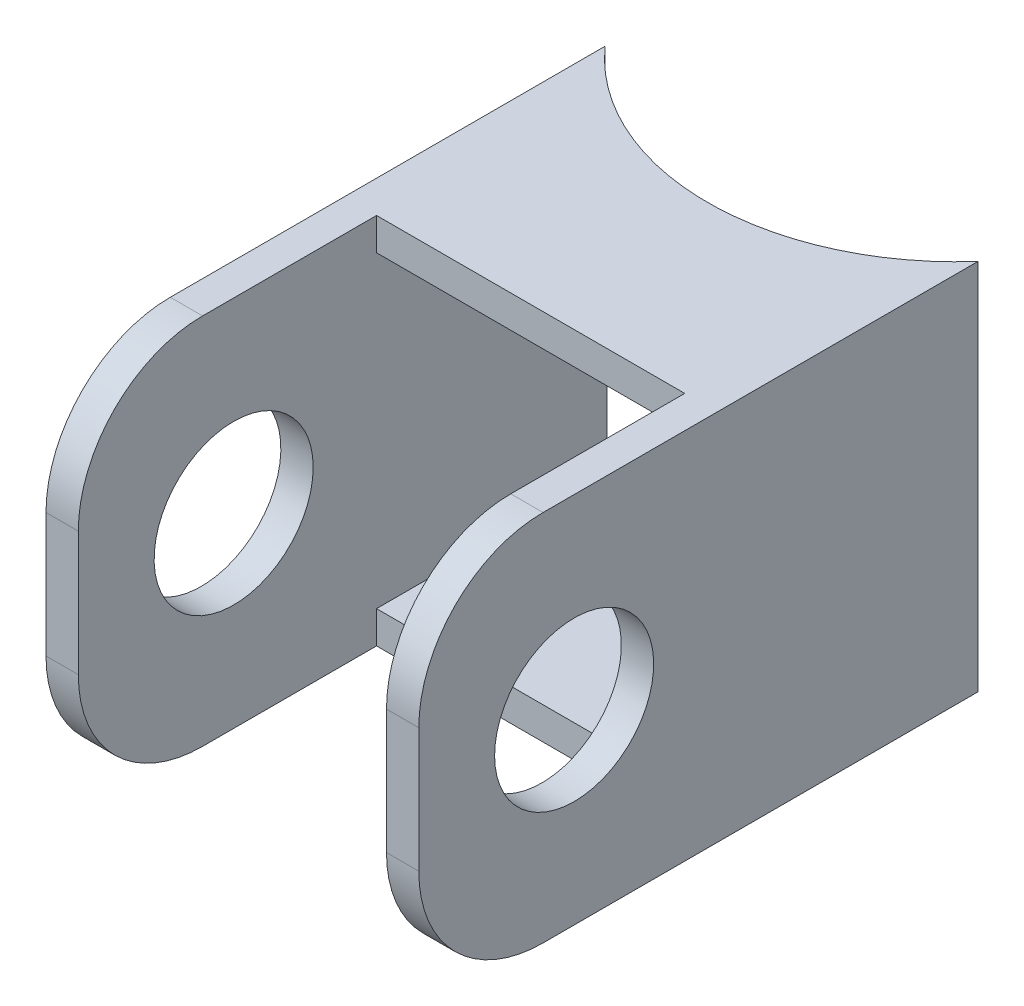
from build123d import *

# Parameters (mm, degrees)
SKETCH1_W               = 19.05
SKETCH1_H               = 19.05
SKETCH1_W_2             = 15.748
SKETCH1_H_2             = 15.748
BOSS_EXTRUDE1_DEPTH     = 28.575
CUT_EXTRUDE5_DEPTH      = 36.639286609
CUT_EXTRUDE5_DEPTH_BACK = 36.639286609
SKETCH5_R               = 12.7
CUT_EXTRUDE2_DEPTH      = 36.639286609
CUT_EXTRUDE2_DEPTH_BACK = 36.639286609
SKETCH3_R               = 4.064
CUT_EXTRUDE4_DEPTH      = 36.639286609
CUT_EXTRUDE4_DEPTH_BACK = 36.639286609
SKETCH4_W               = 15.748
SKETCH4_H               = 15.24
FILLET2_R               = 6.35


with BuildPart() as part:
    # Sketch1 → Boss-Extrude1 (new body)
    with BuildSketch(Plane.XY):
        Rectangle(SKETCH1_W, SKETCH1_H)
        Rectangle(SKETCH1_W_2, SKETCH1_H_2, mode=Mode.SUBTRACT)
    extrude(amount=BOSS_EXTRUDE1_DEPTH)

    # Sketch5 → Cut-Extrude5 (cut, two sides: drawn at the far end of the back side and taken through both)
    with BuildSketch(Plane(origin=(0, 9.525, 0), x_dir=(1, 0, 0), z_dir=(0, 1, 0)).offset(-CUT_EXTRUDE5_DEPTH_BACK)):
        with Locations((0, 8.400260413)):
            Circle(SKETCH5_R)
    extrude(amount=CUT_EXTRUDE5_DEPTH + CUT_EXTRUDE5_DEPTH_BACK, mode=Mode.SUBTRACT)

    # Sketch3 → Cut-Extrude2 (cut, two sides: drawn at the far end of the back side and taken through both)
    with BuildSketch(Plane(origin=(9.525, 0, 0), x_dir=(0, 0, -1), z_dir=(1, 0, 0)).offset(-CUT_EXTRUDE2_DEPTH_BACK)):
        with Locations((-20.6375, 0)):
            Circle(SKETCH3_R)
    extrude(amount=CUT_EXTRUDE2_DEPTH + CUT_EXTRUDE2_DEPTH_BACK, mode=Mode.SUBTRACT)

    # Sketch4 → Cut-Extrude4 (cut, two sides: drawn at the far end of the back side and taken through both)
    with BuildSketch(Plane.XZ.offset(9.525).offset(-CUT_EXTRUDE4_DEPTH_BACK)):
        with Locations((0, 20.955)):
            Rectangle(SKETCH4_W, SKETCH4_H)
    extrude(amount=CUT_EXTRUDE4_DEPTH + CUT_EXTRUDE4_DEPTH_BACK, mode=Mode.SUBTRACT)

    # Fillet2
    fillet2_edges = [part.edges().sort_by_distance(p)[0] for p in [
        (-8.6995, 9.525, 28.575),
        (8.6995, 9.525, 28.575),
        (-8.6995, -9.525, 28.575),
        (8.6995, -9.525, 28.575),
    ]]
    fillet(fillet2_edges, radius=FILLET2_R)


solid = part.part
